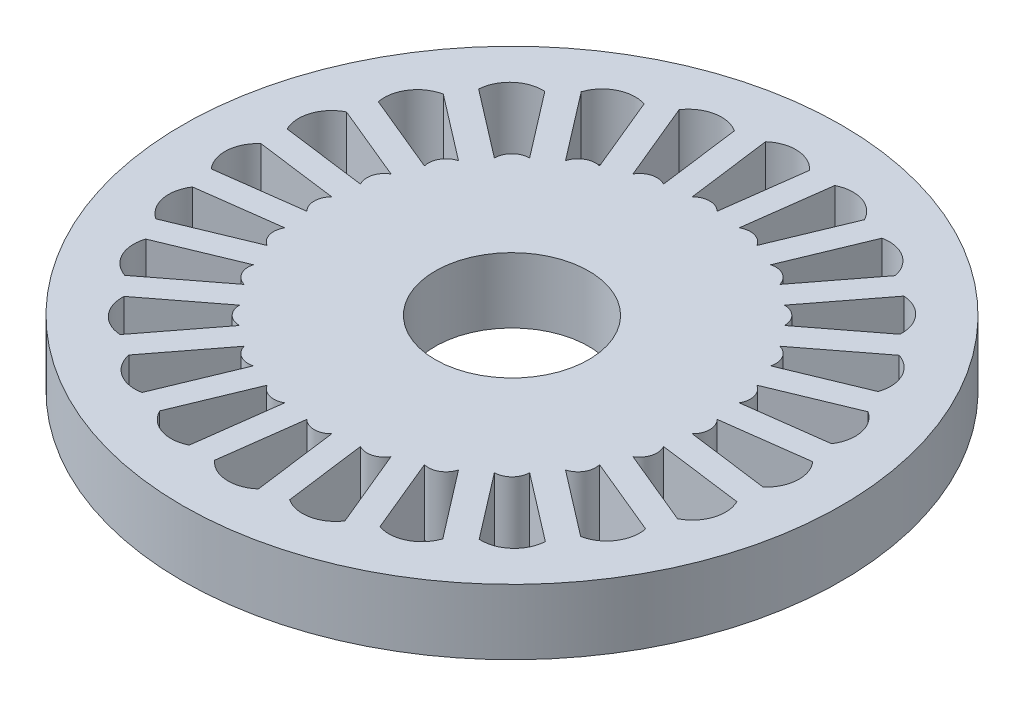
from build123d import *

# Parameters (mm, degrees)
SKETCH2_R           = 12.875
SKETCH2_R_2         = 3
BOSS_EXTRUDE1_DEPTH = 2.55
CUT_EXTRUDE1_DEPTH  = 2.55
CIRPATTERN1_COUNT   = 24


with BuildPart() as part:
    # Sketch2 → Boss-Extrude1 (new body)
    with BuildSketch(Plane(origin=(0, 0, 0), x_dir=(1, 0, 0), z_dir=(0, 1, 0))):
        with Locations(Location((0, 0, 0), (0, 0, 270))):
            Circle(SKETCH2_R)
        with Locations(Location((0, 0, 0), (0, 0, 270))):
            Circle(SKETCH2_R_2, mode=Mode.SUBTRACT)
    extrude(amount=BOSS_EXTRUDE1_DEPTH)

    # Sketch4 → Cut-Extrude1 (cut)
    with BuildSketch(Plane(origin=(0, 2.55, 0), x_dir=(1, 0, 0), z_dir=(0, 1, 0))):
        with BuildLine():
            Line((0.486824592, 7.528448687), (0.906471755, 10.715985352))
            ThreePointArc((0.906471755, 10.715985352), (0.015796353, 11.15041104), (-0.921191613, 10.827793773))
            Line((-0.921191613, 10.827793773), (-0.486824592, 7.528448687))
            ThreePointArc((-0.486824592, 7.528448687), (0, 7.730098035), (0.486824592, 7.528448687))
        make_face()
    cut_extrude1 = extrude(amount=-CUT_EXTRUDE1_DEPTH, mode=Mode.SUBTRACT)

    # CirPattern1: Cut-Extrude1 ×24 about axis
    cirpattern1_axis = Axis((0, 0, 0), (0, 1, 0))
    for i in range(1, CIRPATTERN1_COUNT):
        add(cut_extrude1.rotate(cirpattern1_axis, i * 360 / CIRPATTERN1_COUNT), mode=Mode.SUBTRACT)


solid = part.part
